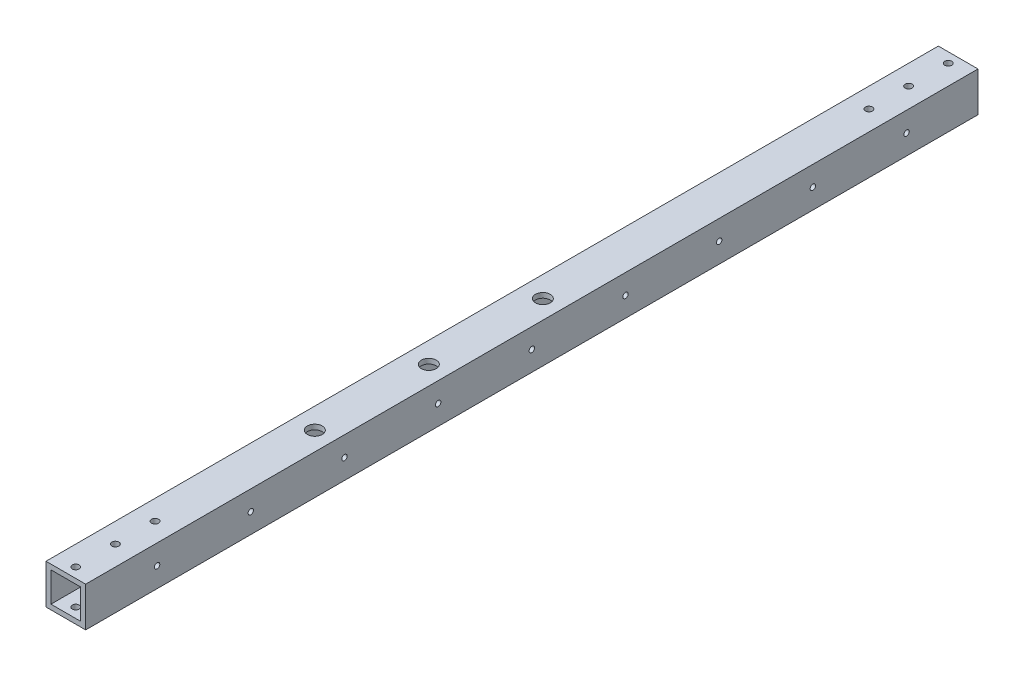
from build123d import *

# Parameters (mm, degrees)
SKETCH1_W                    = 25.4
SKETCH1_H                    = 25.4
SKETCH1_W_2                  = 19.05
SKETCH1_H_2                  = 19.05
EXTRUDE_THIN1_DEPTH          = 571.5
F_8_CLEARANCE_HOLE1_D        = 4.4958
F_8_32_TAPPED_HOLE1_D        = 3.4544
F_8_32_TAPPED_HOLE1_DEPTH    = 10.70864
F_8_32_TAPPED_HOLE1_TIP      = 1.037806461
F_3_8_0_375_DIAMETER_HOLE2_D = 9.525


with BuildPart() as part:
    # Sketch1 → Extrude-Thin1 (new body)
    with BuildSketch(Plane.XY):
        Rectangle(SKETCH1_W, SKETCH1_H)
        Rectangle(SKETCH1_W_2, SKETCH1_H_2, mode=Mode.SUBTRACT)
    extrude(amount=EXTRUDE_THIN1_DEPTH)

    # #8 Clearance Hole1 (through all)
    with Locations(Plane(origin=(0, 12.7, 565.15), x_dir=(0, 0, 1), z_dir=(0, 1, 0))):
        with Locations((0, 0), (-558.8, 0), (-533.4, 0), (-508, 0), (-25.4, 0), (-50.8, 0)):
            Hole(F_8_CLEARANCE_HOLE1_D / 2)

    # #8-32 Tapped Hole1
    with Locations(Plane(origin=(12.7, 82.55, 285.75), x_dir=(0, 0, 1), z_dir=(1, 0, 0))):
        with Locations((-300, 82.55), (-240, 82.55), (-180, 82.55), (-60, 82.55), (0, 82.55), (60, 82.55), (120, 82.55), (180, 82.55), (240, 82.55), (-120, 82.55), (-360, 82.55), (300, 82.55), (360, 82.55)):
            Hole(F_8_32_TAPPED_HOLE1_D / 2, depth=F_8_32_TAPPED_HOLE1_DEPTH)
            with Locations((0, 0, -(F_8_32_TAPPED_HOLE1_DEPTH + F_8_32_TAPPED_HOLE1_TIP / 2))):  # 118° drill point
                Cone(0, F_8_32_TAPPED_HOLE1_D / 2, F_8_32_TAPPED_HOLE1_TIP, mode=Mode.SUBTRACT)

    # 3/8 (0.375) Diameter Hole2 (through all)
    with Locations(Plane(origin=(-346.075, -12.7, 285.75), x_dir=(0, 0, 1), z_dir=(0, -1, 0))):
        with Locations((-92.583, 346.075), (-35.433, 346.075), (35.814, 346.075), (92.964, 346.075), (-19.05, -346.775), (53.975, -346.775), (127, -346.775), (-381, -114.3), (-381, -130.175), (-381, -146.05), (-381, 114.3), (-381, 98.425), (-381, 82.55)):
            Hole(F_3_8_0_375_DIAMETER_HOLE2_D / 2)


solid = part.part
